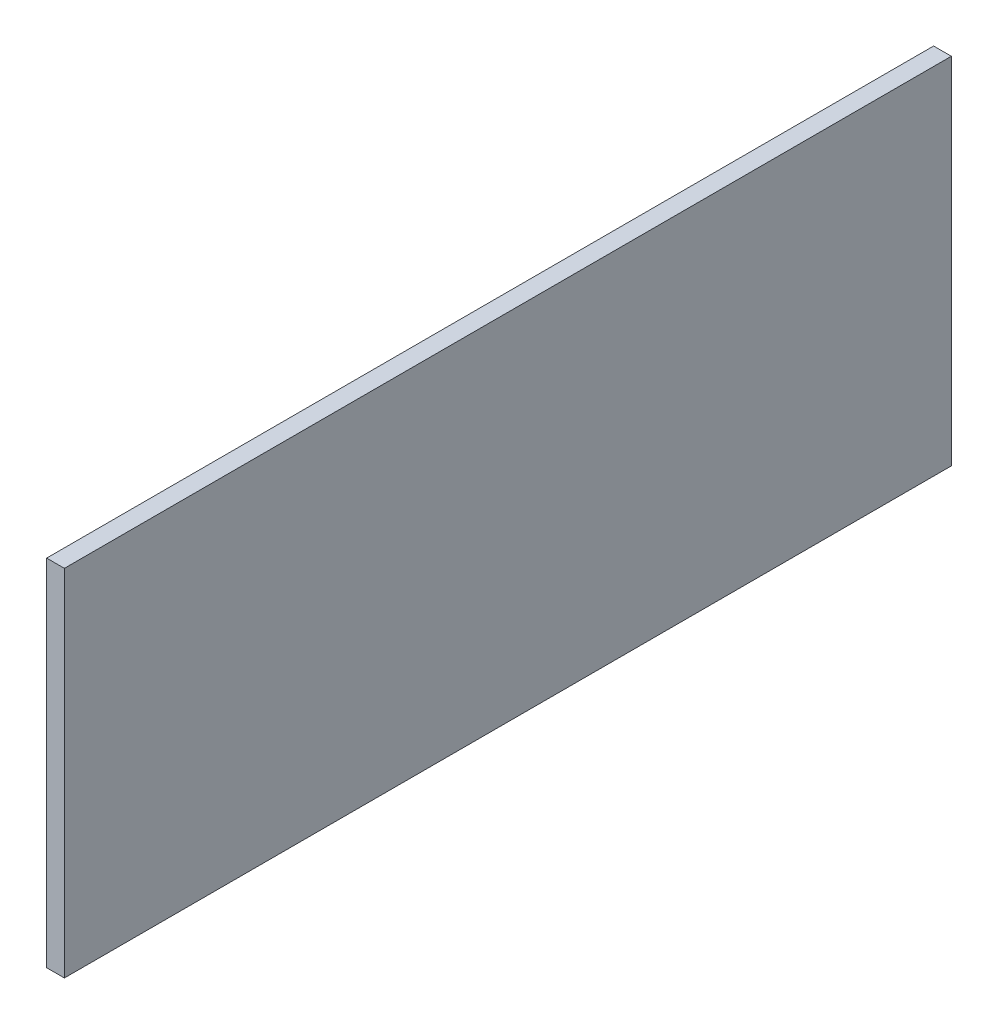
from build123d import *

# Parameters (mm, degrees)
SKETCH1_W           = 100
SKETCH1_H           = 40
BOSS_EXTRUDE1_DEPTH = 2


with BuildPart() as part:
    # Sketch1 → Boss-Extrude1 (new body)
    with BuildSketch(Plane(origin=(0, 0, 0), x_dir=(0, 0, -1), z_dir=(1, 0, 0))):
        Rectangle(SKETCH1_W, SKETCH1_H)
    extrude(amount=BOSS_EXTRUDE1_DEPTH)


solid = part.part
